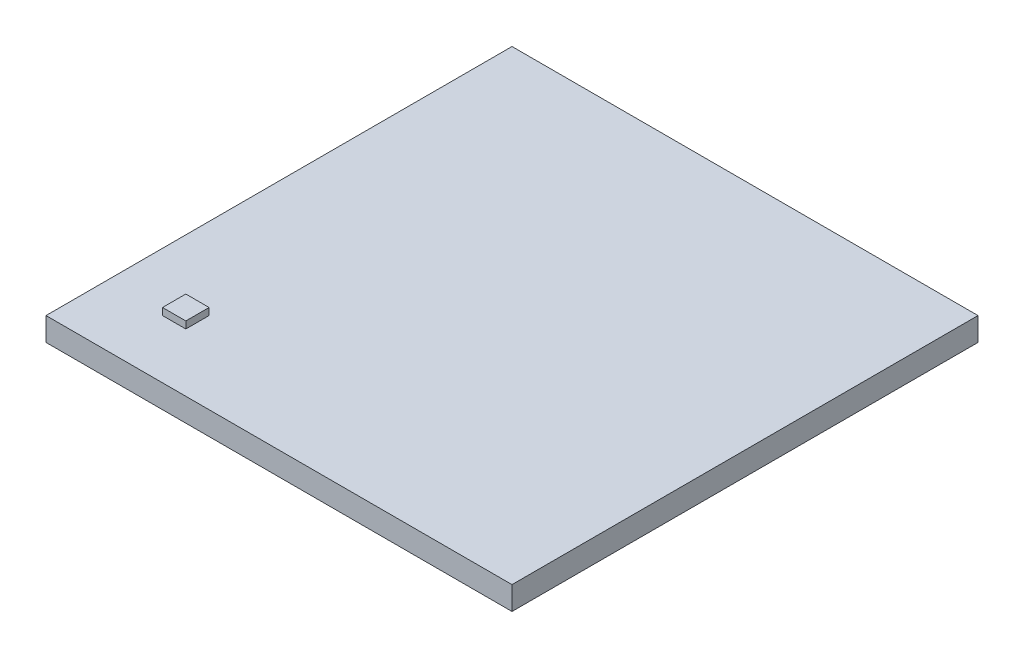
from build123d import *

# Parameters (mm, degrees)
BOSS_EXTRU_1_DEPTH = 20
ESQUISSE1_3_W      = 20
ESQUISSE1_3_H      = 20
BOSS_EXTRU_2_DEPTH = 6


with BuildPart() as part:
    # Esquisse1 → Boss.-Extru.1 (new body)
    with BuildSketch(Plane(origin=(0, 0, 0), x_dir=(1, 0, 0), z_dir=(0, 1, 0))):
        Polygon((0, 0), (200, 0), (200, 400), (-200, 400), (-200, 0), align=None)
    extrude(amount=-BOSS_EXTRU_1_DEPTH)

    # Esquisse1<3> → Boss.-Extru.2 (add)
    with BuildSketch(Plane(origin=(0, 0, 0), x_dir=(1, 0, 0), z_dir=(0, 1, 0))):
        with Locations((-140, 60)):
            Rectangle(ESQUISSE1_3_W, ESQUISSE1_3_H)
    extrude(amount=BOSS_EXTRU_2_DEPTH)


solid = part.part
